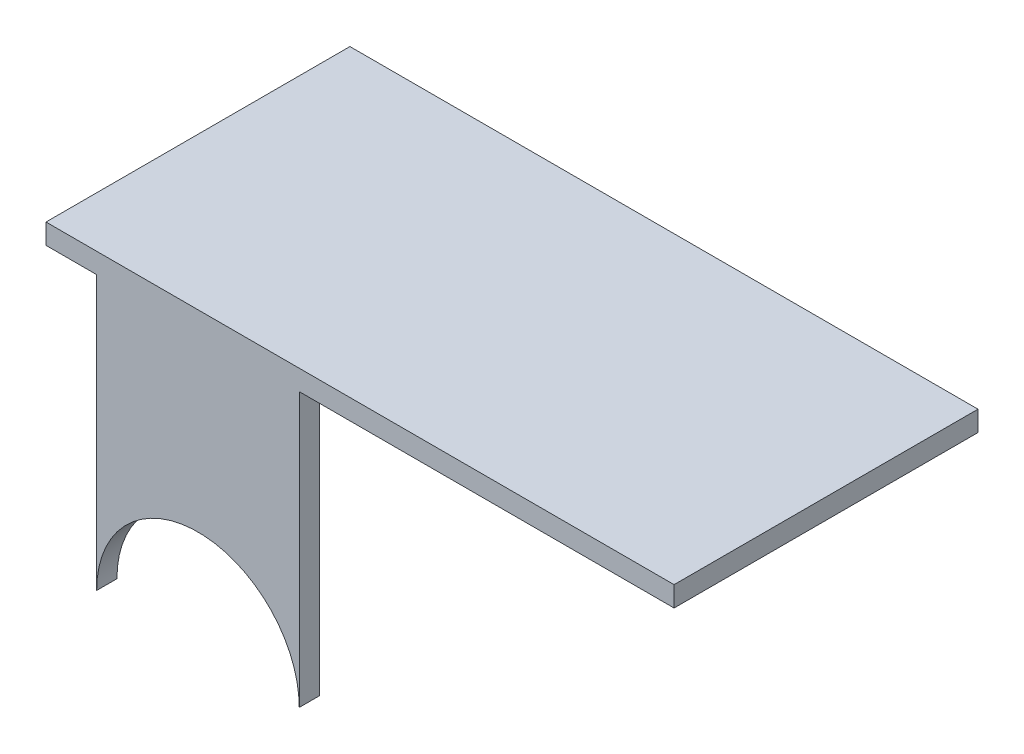
from build123d import *

# Parameters (mm, degrees)
BOSS_EXTRUDE1_DEPTH = 2
BOSS_EXTRUDE2_DEPTH = 2


with BuildPart() as part:
    # Sketch2 → Boss-Extrude1 (new body)
    with BuildSketch(Plane.XY):
        with BuildLine():
            Line((-44.924968499, -5.131156509), (-44.924968499, 21.868843491))
            Line((-44.924968499, 21.868843491), (-24.924968499, 21.868843491))
            Line((-24.924968499, 21.868843491), (-24.924968499, -5.131156509))
            ThreePointArc((-24.924968499, -5.131156509), (-34.924968499, 4.868843491), (-44.924968499, -5.131156509))
        make_face()
    extrude(amount=BOSS_EXTRUDE1_DEPTH)

    # Sketch3 → Boss-Extrude2 (add)
    with BuildSketch(Plane(origin=(0, 21.868843491, 0), x_dir=(1, 0, 0), z_dir=(0, 1, 0))):
        Polygon((-44.924968499, -2), (-49.924968499, -2), (-49.924968499, 28), (12.075031501, 28), (12.075031501, -2), align=None)
    extrude(amount=BOSS_EXTRUDE2_DEPTH)


solid = part.part
